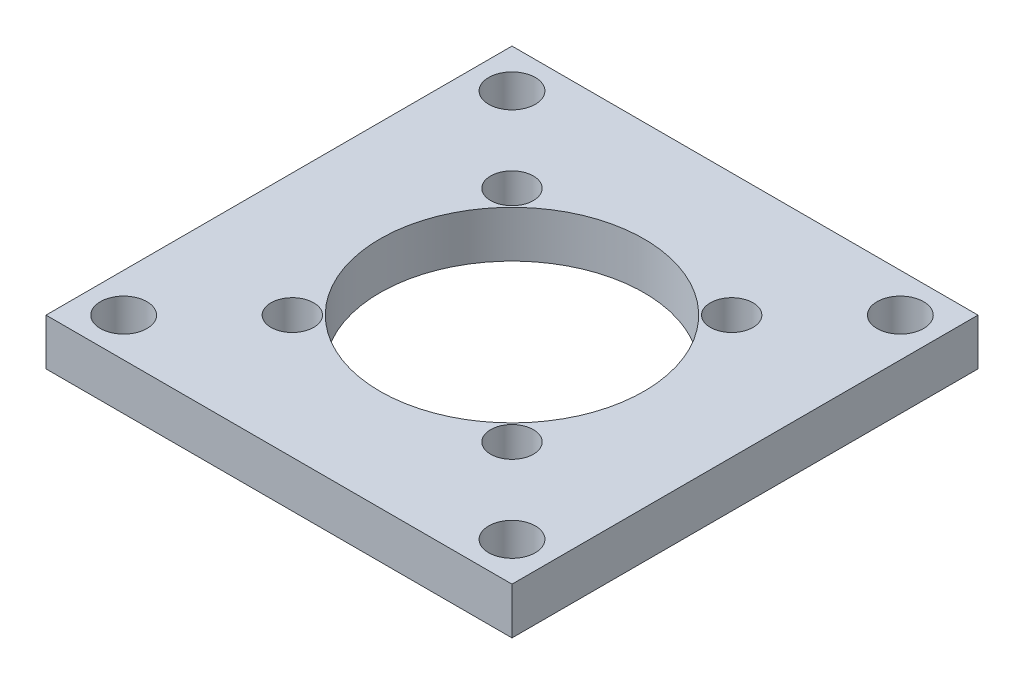
from build123d import *

# Parameters (mm, degrees)
SKETCH1_W           = 60
SKETCH1_H           = 60
SKETCH1_R           = 2.75
SKETCH1_R_2         = 17
BOSS_EXTRUDE1_DEPTH = 6
SKETCH3_R           = 3
CUT_EXTRUDE1_DEPTH  = 10


with BuildPart() as part:
    # Sketch1 → Boss-Extrude1 (new body)
    with BuildSketch(Plane(origin=(0, 0, 0), x_dir=(1, 0, 0), z_dir=(0, 1, 0))):
        with Locations((30, 30)):
            Rectangle(SKETCH1_W, SKETCH1_H)
        with Locations(Location((15.857864376, 44.142135624, 0), (0, 0, 270))):
            Circle(SKETCH1_R, mode=Mode.SUBTRACT)
        with Locations(Location((30, 30, 0), (0, 0, 270))):
            Circle(SKETCH1_R_2, mode=Mode.SUBTRACT)
        with Locations(Location((44.142135624, 44.142135624, 0), (0, 0, 270))):
            Circle(SKETCH1_R, mode=Mode.SUBTRACT)
        with Locations(Location((44.142135624, 15.857864376, 0), (0, 0, 270))):
            Circle(SKETCH1_R, mode=Mode.SUBTRACT)
        with Locations(Location((15.857864376, 15.857864376, 0), (0, 0, 270))):
            Circle(SKETCH1_R, mode=Mode.SUBTRACT)
    extrude(amount=BOSS_EXTRUDE1_DEPTH)

    # Sketch3 → Cut-Extrude1 (cut)
    with BuildSketch(Plane(origin=(0, 6, 0), x_dir=(1, 0, 0), z_dir=(0, 1, 0))):
        with Locations(Location((5, 55, 0), (0, 0, 270))):
            Circle(SKETCH3_R)
        with Locations(Location((55, 55, 0), (0, 0, 270))):
            Circle(SKETCH3_R)
        with Locations(Location((55, 5, 0), (0, 0, 270))):
            Circle(SKETCH3_R)
        with Locations(Location((5, 5, 0), (0, 0, 270))):
            Circle(SKETCH3_R)
    extrude(amount=-CUT_EXTRUDE1_DEPTH, mode=Mode.SUBTRACT)


solid = part.part
